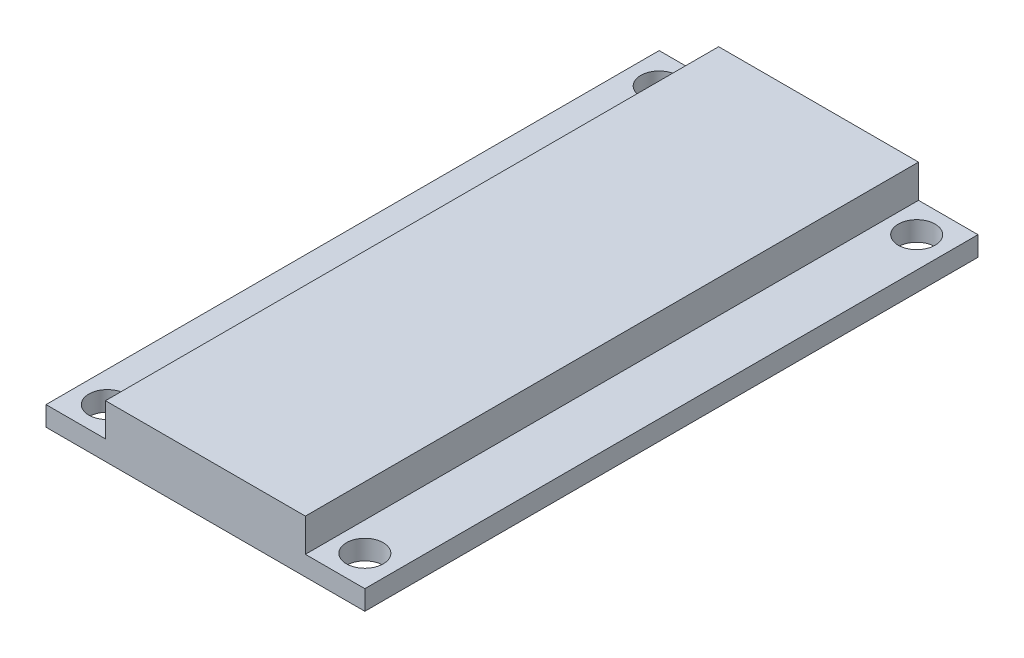
from build123d import *

# Parameters (mm, degrees)
SKETCH1_W           = 26
SKETCH1_H           = 50
BOSS_EXTRUDE1_DEPTH = 1.6
SKETCH2_R           = 1.5
CUT_EXTRUDE1_DEPTH  = 57.37871939
SKETCH3_W           = 16.3
SKETCH3_H           = 50
BOSS_EXTRUDE2_DEPTH = 2.7


with BuildPart() as part:
    # Sketch1 → Boss-Extrude1 (new body)
    with BuildSketch(Plane(origin=(0, 0, 0), x_dir=(1, 0, 0), z_dir=(0, 1, 0))):
        with Locations((13, 25)):
            Rectangle(SKETCH1_W, SKETCH1_H)
    extrude(amount=BOSS_EXTRUDE1_DEPTH)

    # Sketch2 → Cut-Extrude1 (cut, through all)
    with BuildSketch(Plane(origin=(0, 1.6, 0), x_dir=(1, 0, 0), z_dir=(0, 1, 0))):
        with Locations(Location((2.5, 2.5, 0), (0, 0, 270))):
            Circle(SKETCH2_R)
        with Locations(Location((23.5, 2.5, 0), (0, 0, 90))):
            Circle(SKETCH2_R)
        with Locations(Location((23.5, 47.5, 0), (0, 0, 270))):
            Circle(SKETCH2_R)
        with Locations(Location((2.5, 47.5, 0), (0, 0, 90))):
            Circle(SKETCH2_R)
    extrude(amount=-CUT_EXTRUDE1_DEPTH, mode=Mode.SUBTRACT)

    # Sketch3 → Boss-Extrude2 (add)
    with BuildSketch(Plane(origin=(0, 1.6, 0), x_dir=(1, 0, 0), z_dir=(0, 1, 0))):
        with Locations((13, 25)):
            Rectangle(SKETCH3_W, SKETCH3_H)
    extrude(amount=BOSS_EXTRUDE2_DEPTH)


solid = part.part
